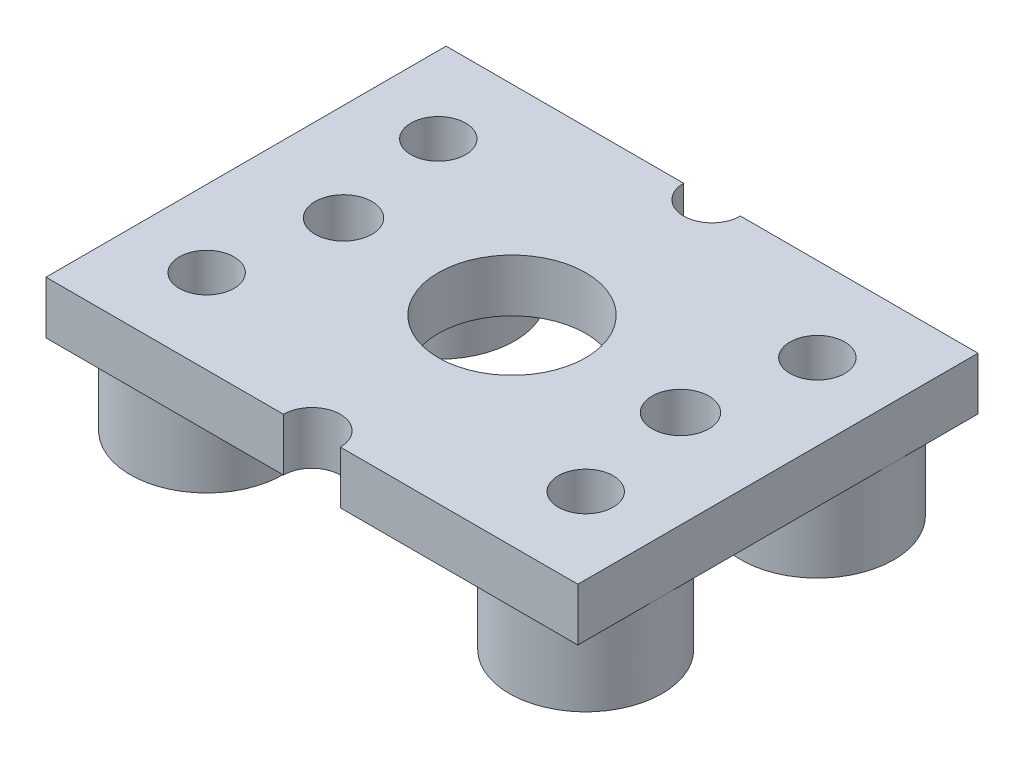
from build123d import *

# Parameters (mm, degrees)
SKETCH1_W             = 29.006558678
SKETCH1_H             = 29.831389996
BOARDMOUNTHOLES_DEPTH = 2.5
SKETCH1_3_R           = 1.3
BOARDMOUNTS_DEPTH     = 21.954070461
BOARDSTANDOFFS_START  = 4
SKETCH3_R             = 3.627144727
SKETCH3_R_2           = 1.3
BOARDSTANDOFFS_DEPTH  = 4
NUTCUTOUT_DEPTH       = 2
SKETCH1_4_R           = 3.5
MAGNETHOLE_DEPTH      = 22.185444741
SKETCH2_R             = 1.35
MOTORMOUNTHOLES_DEPTH = 22.796170968
SKETCH5_OUTSIDE_W     = 39.428
SKETCH5_OUTSIDE_H     = 40.254
SKETCH5_OUTSIDE_W_2   = 25.254289454
SKETCH5_OUTSIDE_H_2   = 19
CUT_EXTRUDE4_DEPTH    = 22.185444741


with BuildPart() as part:
    # Sketch1 → BoardMountHoles (new body)
    with BuildSketch(Plane(origin=(0, 0, 0), x_dir=(1, 0, 0), z_dir=(0, 1, 0))):
        Rectangle(SKETCH1_W, SKETCH1_H)
    extrude(amount=BOARDMOUNTHOLES_DEPTH)

    # Sketch1<3> → BoardMounts (cut, through all)
    with BuildSketch(Plane(origin=(0, 0, 0), x_dir=(1, 0, 0), z_dir=(0, 1, 0))):
        with Locations((9, 5.5)):
            Circle(SKETCH1_3_R)
        with Locations((9, -5.5)):
            Circle(SKETCH1_3_R)
        with Locations((-9, -5.5)):
            Circle(SKETCH1_3_R)
        with Locations((-9, 5.5)):
            Circle(SKETCH1_3_R)
    extrude(amount=BOARDMOUNTS_DEPTH, mode=Mode.SUBTRACT)

    # Sketch3 → BoardStandoffs (add)
    # profile 1 of 4: a face of its own
    with BuildSketch(Plane.XZ.offset(BOARDSTANDOFFS_START)):
        with Locations((9, 5.5)):
            Circle(SKETCH3_R)
        with Locations((9, 5.5)):
            Circle(SKETCH3_R_2, mode=Mode.SUBTRACT)
    # profile 2 of 4: a face of its own
    with BuildSketch(Plane.XZ.offset(BOARDSTANDOFFS_START)):
        with Locations((9, -5.5)):
            Circle(SKETCH3_R)
        with Locations((9, -5.5)):
            Circle(SKETCH3_R_2, mode=Mode.SUBTRACT)
    # profile 3 of 4: a face of its own
    with BuildSketch(Plane.XZ.offset(BOARDSTANDOFFS_START)):
        with Locations((-9, -5.5)):
            Circle(SKETCH3_R)
        with Locations((-9, -5.5)):
            Circle(SKETCH3_R_2, mode=Mode.SUBTRACT)
    # profile 4 of 4: a face of its own
    with BuildSketch(Plane.XZ.offset(BOARDSTANDOFFS_START)):
        with Locations((-9, 5.5)):
            Circle(SKETCH3_R)
        with Locations((-9, 5.5)):
            Circle(SKETCH3_R_2, mode=Mode.SUBTRACT)
    extrude(amount=-BOARDSTANDOFFS_DEPTH)

    # Sketch4 → NutCutout (cut)
    with BuildSketch(Plane.XZ.offset(4)):
        Polygon((12.175426481, -5.5), (10.58771324, -2.75), (7.41228676, -2.75), (5.824573519, -5.5), (7.41228676, -8.25), (10.58771324, -8.25), align=None)
        Polygon((-5.824573519, -5.5), (-7.41228676, -2.75), (-10.58771324, -2.75), (-12.175426481, -5.5), (-10.58771324, -8.25), (-7.41228676, -8.25), align=None)
        Polygon((-5.824573519, 5.5), (-7.41228676, 8.25), (-10.58771324, 8.25), (-12.175426481, 5.5), (-10.58771324, 2.75), (-7.41228676, 2.75), align=None)
        Polygon((12.175426481, 5.5), (10.58771324, 8.25), (7.41228676, 8.25), (5.824573519, 5.5), (7.41228676, 2.75), (10.58771324, 2.75), align=None)
    extrude(amount=-NUTCUTOUT_DEPTH, mode=Mode.SUBTRACT)

    # Sketch1<4> → MagnetHole (cut, through all)
    with BuildSketch(Plane(origin=(0, 0, 0), x_dir=(1, 0, 0), z_dir=(0, 1, 0))):
        Circle(SKETCH1_4_R)
    extrude(amount=MAGNETHOLE_DEPTH, mode=Mode.SUBTRACT)

    # Sketch2 → MotorMountHoles (cut, through all)
    with BuildSketch(Plane(origin=(0, 2.5, 0), x_dir=(1, 0, 0), z_dir=(0, 1, 0))):
        with Locations((8, 0)):
            Circle(SKETCH2_R)
        with Locations((0, 9.5)):
            Circle(SKETCH2_R)
        with Locations((-8, 0)):
            Circle(SKETCH2_R)
        with Locations((0, -9.5)):
            Circle(SKETCH2_R)
    extrude(amount=-MOTORMOUNTHOLES_DEPTH, mode=Mode.SUBTRACT)

    # Sketch5 outside → Cut-Extrude4 (cut, through all)
    with BuildSketch(Plane.XZ):
        Rectangle(SKETCH5_OUTSIDE_W, SKETCH5_OUTSIDE_H)
        Rectangle(SKETCH5_OUTSIDE_W_2, SKETCH5_OUTSIDE_H_2, mode=Mode.SUBTRACT)
    extrude(amount=-CUT_EXTRUDE4_DEPTH, mode=Mode.SUBTRACT)


solid = part.part
